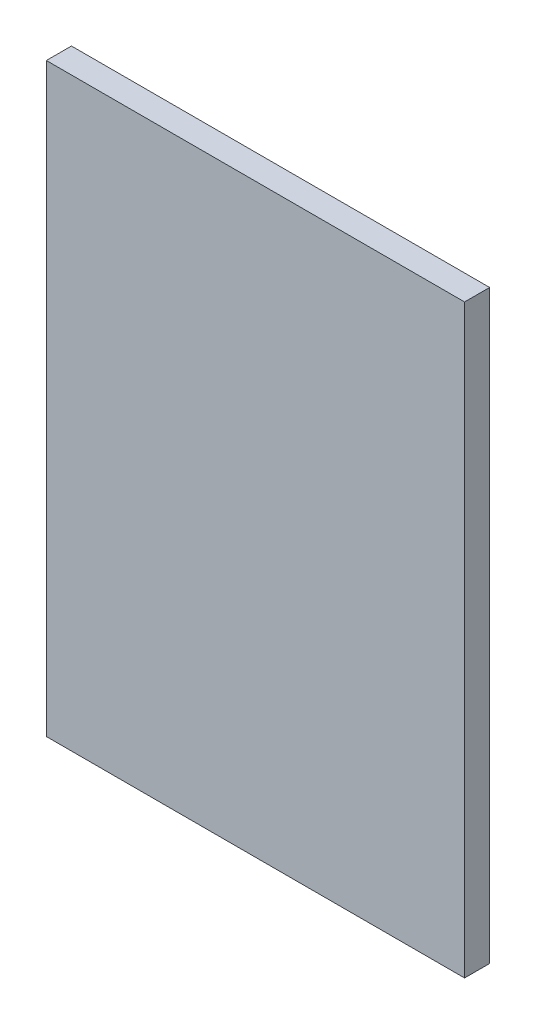
from build123d import *

# Parameters (mm, degrees)
SKETCH_1_W      = 25
SKETCH_1_H      = 35
EXTRUDE_1_DEPTH = 1.5


with BuildPart() as part:
    # Эскиз1 → Вытянуть1 (new body)
    with BuildSketch(Plane.XY):
        Rectangle(SKETCH_1_W, SKETCH_1_H)
    extrude(amount=EXTRUDE_1_DEPTH)


solid = part.part
